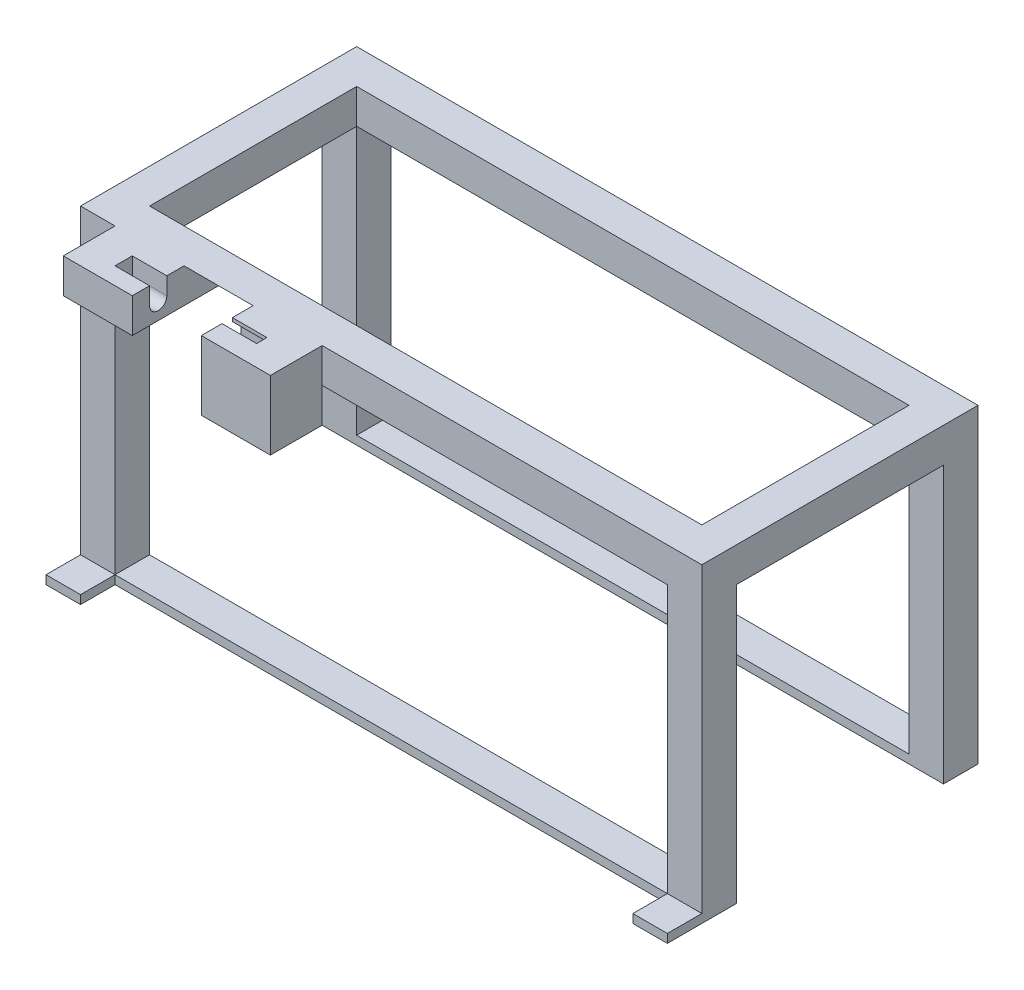
from build123d import *

# Parameters (mm, degrees)
SKETCH1_W                      = 25.4
SKETCH1_H                      = 25.4
SKETCH1_W_2                    = 406.4
BOSS_EXTRUDE1_DEPTH            = 6.35
SKETCH1_4_W                    = 25.4
SKETCH1_4_H                    = 25.4
BOSS_EXTRUDE2_DEPTH            = 228.6
BOSS_EXTRUDE3_START            = 203.2
SKETCH1_5_W                    = 406.4
SKETCH1_5_H                    = 25.4
SKETCH1_5_W_2                  = 25.4
SKETCH1_5_H_2                  = 152.4
BOSS_EXTRUDE3_DEPTH            = 25.4
SKETCH2_W                      = 50.8
SKETCH2_H                      = 25.4
BOSS_EXTRUDE4_DEPTH            = 38.1
F_1_2_0_5_DIAMETER_HOLE1_D     = 12.7
F_1_2_0_5_DIAMETER_HOLE1_DEPTH = 25.4
SKETCH5_W                      = 50.8
SKETCH5_H                      = 38.1
BOSS_EXTRUDE5_DEPTH            = 25.4
SKETCH6_W                      = 20.32
SKETCH6_H                      = 40.132
CUT_EXTRUDE1_DEPTH             = 27.94
CUT_EXTRUDE2_DEPTH             = 12.7
CUT_EXTRUDE3_DEPTH             = 12.7
CUT_EXTRUDE4_START             = -76.2
CUT_EXTRUDE4_DEPTH             = 50.8


with BuildPart() as part:
    # Sketch1 → Boss-Extrude1 (new body)
    with BuildSketch(Plane(origin=(0, 0, 0), x_dir=(1, 0, 0), z_dir=(0, 1, 0))):
        with Locations((-215.9, -88.9)):
            Rectangle(SKETCH1_W, SKETCH1_H)
        with Locations((-215.9, -114.3)):
            Rectangle(SKETCH1_W, SKETCH1_H)
        with Locations((0, -88.9)):
            Rectangle(SKETCH1_W_2, SKETCH1_H)
        with Locations((215.9, -88.9)):
            Rectangle(SKETCH1_W, SKETCH1_H)
        with Locations((215.9, -114.3)):
            Rectangle(SKETCH1_W, SKETCH1_H)
        with Locations((0, 88.9)):
            Rectangle(SKETCH1_W_2, SKETCH1_H)
    extrude(amount=BOSS_EXTRUDE1_DEPTH)

    # Sketch1<4> → Boss-Extrude2 (add)
    with BuildSketch(Plane(origin=(0, 0, 0), x_dir=(1, 0, 0), z_dir=(0, 1, 0))):
        with Locations((-215.9, -88.9)):
            Rectangle(SKETCH1_4_W, SKETCH1_4_H)
        with Locations((215.9, -88.9)):
            Rectangle(SKETCH1_4_W, SKETCH1_4_H)
        with Locations((215.9, 88.9)):
            Rectangle(SKETCH1_4_W, SKETCH1_4_H)
        with Locations((-215.9, 88.9)):
            Rectangle(SKETCH1_4_W, SKETCH1_4_H)
    extrude(amount=BOSS_EXTRUDE2_DEPTH)

    # Sketch1<5> → Boss-Extrude3 (add)
    with BuildSketch(Plane(origin=(0, 0, 0), x_dir=(1, 0, 0), z_dir=(0, 1, 0)).offset(BOSS_EXTRUDE3_START)):
        with Locations((0, 88.9)):
            Rectangle(SKETCH1_5_W, SKETCH1_5_H)
        with Locations((0, -88.9)):
            Rectangle(SKETCH1_5_W, SKETCH1_5_H)
        with Locations((-215.9, 0)):
            Rectangle(SKETCH1_5_W_2, SKETCH1_5_H_2)
        with Locations((215.9, 0)):
            Rectangle(SKETCH1_5_W_2, SKETCH1_5_H_2)
    extrude(amount=BOSS_EXTRUDE3_DEPTH)

    # Sketch2 → Boss-Extrude4 (add)
    with BuildSketch(Plane.XY.offset(101.6)):
        with Locations((-177.8, 215.9)):
            Rectangle(SKETCH2_W, SKETCH2_H)
        with Locations((-76.2, 215.9)):
            Rectangle(SKETCH2_W, SKETCH2_H)
    extrude(amount=BOSS_EXTRUDE4_DEPTH)

    # 1/2 (0.5) Diameter Hole1
    with Locations(Plane(origin=(-152.4, 0, 0), x_dir=(0, 0, -1), z_dir=(1, 0, 0))):
        with Locations((-120.65, 215.9)):
            Hole(F_1_2_0_5_DIAMETER_HOLE1_D / 2, depth=F_1_2_0_5_DIAMETER_HOLE1_DEPTH)

    # Sketch5 → Boss-Extrude5 (add)
    with BuildSketch(Plane.XZ.offset(-203.2)):
        with Locations((-76.2, 120.65)):
            Rectangle(SKETCH5_W, SKETCH5_H)
    extrude(amount=BOSS_EXTRUDE5_DEPTH)

    # Sketch6 → Cut-Extrude1 (cut)
    with BuildSketch(Plane.ZY.offset(101.6)):
        with Locations((120.65, 205.994)):
            Rectangle(SKETCH6_W, SKETCH6_H)
    extrude(amount=-CUT_EXTRUDE1_DEPTH, mode=Mode.SUBTRACT)

    # Sketch7 → Cut-Extrude2 (cut)
    with BuildSketch(Plane(origin=(0, 228.6, 0), x_dir=(1, 0, 0), z_dir=(0, 1, 0))):
        Polygon((-152.4, -127), (-152.4, -114.3), (-177.8, -114.3), (-177.8, -120.65), (-177.8, -127), align=None)
    extrude(amount=-CUT_EXTRUDE2_DEPTH, mode=Mode.SUBTRACT)

    # Sketch8 → Cut-Extrude3 (cut)
    with BuildSketch(Plane(origin=(0, 228.6, 0), x_dir=(1, 0, 0), z_dir=(0, 1, 0))):
        Polygon((-101.6, -124.46), (-76.2, -124.46), (-76.2, -120.65), (-76.2, -116.84), (-101.6, -116.84), (-101.6, -120.65), align=None)
    extrude(amount=-CUT_EXTRUDE3_DEPTH, mode=Mode.SUBTRACT)

    # Sketch9 → Cut-Extrude4 (cut)
    with BuildSketch(Plane.ZY.offset(228.6).offset(CUT_EXTRUDE4_START)):
        Polygon((76.2, 203.2), (101.6, 228.6), (101.6, 203.2), align=None)
    extrude(amount=-CUT_EXTRUDE4_DEPTH, mode=Mode.SUBTRACT)


solid = part.part
